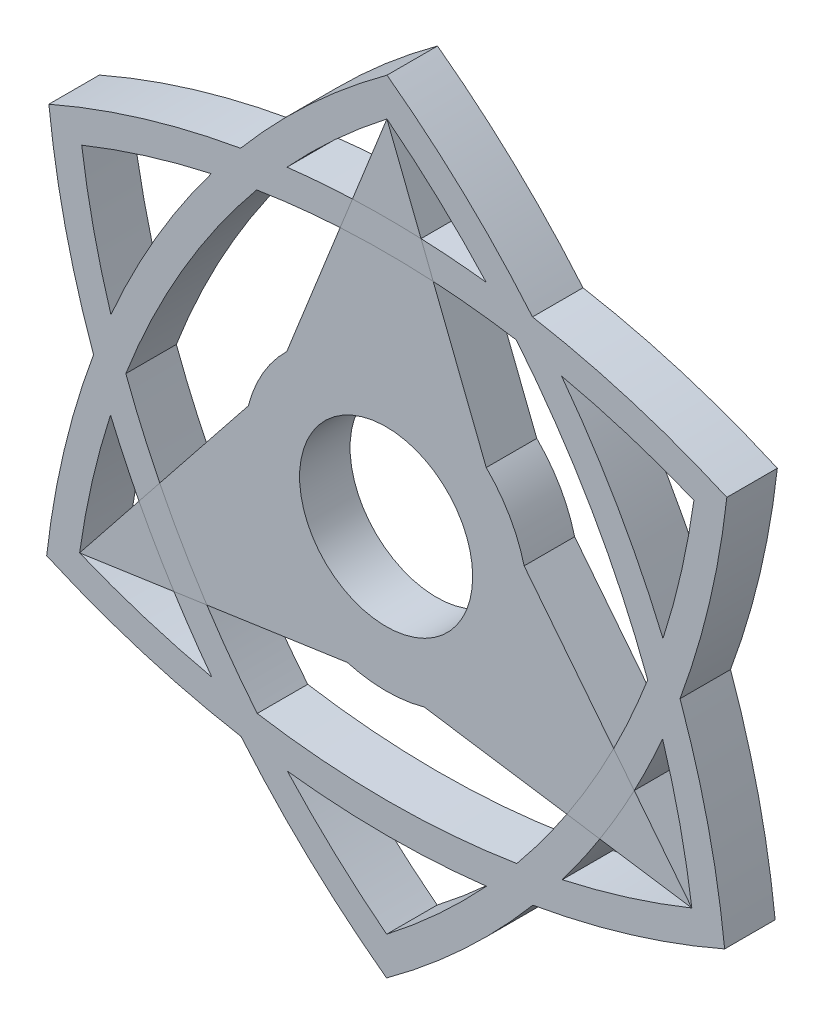
from build123d import *

# Parameters (mm, degrees)
SKETCH1_R             = 10.8839
BOSS_EXTRUDE6_DEPTH   = 6.35
BOSS_EXTRUDE7_DEPTH   = 6.35
BOSS_EXTRUDE7_2_DEPTH = 6.35
BOSS_EXTRUDE7_3_DEPTH = 6.35
BOSS_EXTRUDE9_DEPTH   = 6.35
BOSS_EXTRUDE9_2_DEPTH = 6.35
BOSS_EXTRUDE9_3_DEPTH = 6.35


with BuildPart() as part:
    # Sketch1 → Boss-Extrude6 (new body)
    # profile 1 of 24: a face of its own
    with BuildSketch(Plane.XY):
        with BuildLine():
            ThreePointArc((18.409251134, 32.040755516), (9.771738625, 41.176595763), (0.112502824, 49.224537306))
            ThreePointArc((0.112502824, 49.224537306), (-9.606010304, 41.189697913), (-18.30255483, 32.058528504))
            ThreePointArc((-18.30255483, 32.058528504), (-30.571274802, 29.148703665), (-42.408118658, 24.803856385))
            ThreePointArc((-42.408118658, 24.803856385), (-40.332235459, 12.393212957), (-36.795986587, 0.317273851))
            ThreePointArc((-36.795986587, 0.317273851), (-40.490763243, -11.918086648), (-42.687382874, -24.508967606))
            ThreePointArc((-42.687382874, -24.508967606), (-30.690753758, -28.982480099), (-18.241181413, -31.972391907))
            ThreePointArc((-18.241181413, -31.972391907), (-9.602962869, -41.094540725), (0.056729858, -49.127146472))
            ThreePointArc((0.056729858, -49.127146472), (9.767597292, -41.108146164), (18.457974155, -31.993177034))
            ThreePointArc((18.457974155, -31.993177034), (30.732404751, -29.071478393), (42.571147661, -24.707748829))
            ThreePointArc((42.571147661, -24.707748829), (40.489963723, -12.317504428), (36.956222495, -0.260881524))
            ThreePointArc((36.956222495, -0.260881524), (40.654785447, 11.998056292), (42.846932906, 24.613737558))
            ThreePointArc((42.846932906, 24.613737558), (30.852413337, 29.065348019), (18.409251134, 32.040755516))
        make_face()
        with BuildLine():
            ThreePointArc((0.065018844, -44.354977085), (-6.415368802, -38.856188804), (-12.414843436, -32.836354861))
            ThreePointArc((-12.414843436, -32.836354861), (0.09972186, -33.588017728), (12.615238804, -32.852370236))
            ThreePointArc((12.615238804, -32.852370236), (6.5802827, -38.865699826), (0.065018844, -44.354977085))
        make_face(mode=Mode.SUBTRACT)
        with BuildLine():
            ThreePointArc((-34.606466943, 5.778884121), (-36.791953917, 14.014759026), (-38.281510247, 22.404467645))
            ThreePointArc((-38.281510247, 22.404467645), (-30.237565046, 25.267072232), (-21.982893443, 27.448804603))
            ThreePointArc((-21.982893443, 27.448804603), (-28.937245051, 16.988163443), (-34.606466943, 5.778884121))
        make_face(mode=Mode.SUBTRACT)
        with BuildLine():
            ThreePointArc((-12.466293025, 32.914387652), (-6.422477615, 38.944419206), (0.103176208, 44.449401263))
            ThreePointArc((0.103176208, 44.449401263), (6.588409661, 38.935289866), (12.591776477, 32.900120912))
            ThreePointArc((12.591776477, 32.900120912), (8.497755055, 33.309033762), (4.390957045, 33.558896188))
            Line((4.390957045, 33.558896188), (5.92278391, 29.668219663))
            ThreePointArc((5.92278391, 29.668219663), (11.164564982, 29.228828773), (16.376824404, 28.520531604))
            ThreePointArc((16.376824404, 28.520531604), (25.810048875, 14.814094453), (32.891805284, -0.242494452))
            ThreePointArc((32.891805284, -0.242494452), (30.876080007, -5.106091555), (28.612333437, -9.859319578))
            Line((28.612333437, -9.859319578), (31.202189282, -13.140569782))
            ThreePointArc((31.202189282, -13.140569782), (33.056613624, -9.465908645), (34.766856331, -5.721967675))
            ThreePointArc((34.766856331, -5.721967675), (36.950597113, -13.941399376), (38.442722573, -22.314053849))
            ThreePointArc((38.442722573, -22.314053849), (30.400141756, -25.188442382), (22.14505035, -27.379031691))
            ThreePointArc((22.14505035, -27.379031691), (24.575188757, -24.02304644), (26.872201387, -20.574576828))
            Line((26.872201387, -20.574576828), (22.732716478, -19.952259237))
            ThreePointArc((22.732716478, -19.952259237), (19.694383336, -24.293248434), (16.434939913, -28.470769715))
            ThreePointArc((16.434939913, -28.470769715), (0.112106411, -29.778024387), (-16.209299898, -28.453069887))
            ThreePointArc((-16.209299898, -28.453069887), (-19.491550025, -24.212899505), (-22.546142131, -19.805896234))
            Line((-22.546142131, -19.805896234), (-26.68787682, -20.408903453))
            ThreePointArc((-26.68787682, -20.408903453), (-24.364609338, -23.931538597), (-21.902564268, -27.358616685))
            ThreePointArc((-21.902564268, -27.358616685), (-30.336237741, -25.103876714), (-38.545898781, -22.135347415))
            ThreePointArc((-38.545898781, -22.135347415), (-36.962894769, -13.566034677), (-34.656199101, -5.162572439))
            ThreePointArc((-34.656199101, -5.162572439), (-32.94297759, -8.999031831), (-31.078611103, -12.764358672))
            Line((-31.078611103, -12.764358672), (-28.470486825, -9.491322424))
            ThreePointArc((-28.470486825, -9.491322424), (-30.729374769, -4.652110953), (-32.731554183, 0.298830371))
            ThreePointArc((-32.731554183, 0.298830371), (-25.640389338, 15.078468804), (-16.279166072, 28.535430944))
            ThreePointArc((-16.279166072, 28.535430944), (-11.044682926, 29.24131847), (-5.780739025, 29.676043211))
            Line((-5.780739025, 29.676043211), (-4.231792218, 33.565145089))
            ThreePointArc((-4.231792218, 33.565145089), (-8.355378448, 33.319938131), (-12.466293025, 32.914387652))
        make_face(mode=Mode.SUBTRACT)
        with BuildLine():
            ThreePointArc((22.061661473, 27.432655446), (30.49539453, 25.18862754), (38.707129377, 22.233813619))
            ThreePointArc((38.707129377, 22.233813619), (37.125952887, 13.643513921), (34.816355895, 5.219789701))
            ThreePointArc((34.816355895, 5.219789701), (29.112988802, 16.713223988), (22.061661473, 27.432655446))
        make_face(mode=Mode.SUBTRACT)
    # profile 2 of 24: a face of its own
    with BuildSketch(Plane.XY):
        with BuildLine():
            Line((28.612333437, -9.859319578), (17.355543552, 4.402610931))
            ThreePointArc((17.355543552, 4.402610931), (17.767289769, 2.218397904), (17.905247136, 0))
            ThreePointArc((17.905247136, 0), (14.252606705, -10.837946166), (4.784950475, -17.254046596))
            Line((4.784950475, -17.254046596), (22.732716478, -19.952259237))
            ThreePointArc((22.732716478, -19.952259237), (25.816973791, -14.989937717), (28.612333437, -9.859319578))
        make_face()
    # profile 3 of 24: a face of its own
    with BuildSketch(Plane.XY):
        with BuildLine():
            ThreePointArc((0.855698515, 17.88478837), (0.613501389, 17.894733612), (0.371191823, 17.901399153))
            add(Edge.make_bspline(
                [(-0.457896071, 16.620461479), (-0.456345669, 16.654814091), (-0.45331947, 16.721866244), (-0.446453992, 16.819875103), (-0.436982287, 16.912792733), (-0.424936518, 17.000622781), (-0.410565326, 17.083218743), (-0.393050996, 17.160542787), (-0.374448988, 17.232885934), (-0.352587387, 17.300724297), (-0.32714287, 17.364906318), (-0.296632223, 17.426403351), (-0.259824473, 17.48477755), (-0.219348783, 17.541715904), (-0.173074336, 17.595859989), (-0.12225701, 17.648106237), (-0.066069886, 17.697775095), (-0.005261137, 17.744433175), (0.059072625, 17.788169664), (0.128082627, 17.824525995), (0.199365721, 17.856413546), (0.274214301, 17.880115675), (0.331872819, 17.893994249), (0.364487692, 17.900195643), (0.371191823, 17.901399153)],
                knots=[0, 0, 0, 0, 1.299619728, 2.536700842, 3.712695391, 4.828862452, 5.886674754, 6.880040802, 7.824574118, 8.708903084, 9.57188436, 10.43188469, 11.299059094, 12.177414763, 13.06998165, 13.987903038, 14.930122486, 15.901331799, 16.883583912, 17.865836025, 18.845371881, 19.831049498, 20.828028267, 21.085378132, 21.085378132, 21.085378132, 21.085378132], degree=3))
            Line((-0.457896071, 16.620461479), (-0.524677922, 14.714316647))
            Line((-0.524677922, 14.714316647), (-0.209213179, 14.703504347))
            Line((-0.209213179, 14.703504347), (-0.142431328, 16.609649179))
            add(Edge.make_bspline(
                [(-0.09345797, 17.102562841), (-0.096306428, 17.091348489), (-0.102666094, 17.066310537), (-0.110862748, 17.024544277), (-0.117488281, 16.974808947), (-0.123877271, 16.917343388), (-0.129488814, 16.851807376), (-0.134488672, 16.778227129), (-0.138955045, 16.696597684), (-0.141236045, 16.639545487), (-0.142431328, 16.609649179)],
                knots=[0, 0, 0, 0, 0.559594287, 1.249389564, 2.057148588, 2.985725436, 4.045954676, 5.238292363, 6.552818884, 8, 8, 8, 8], degree=3))
            add(Edge.make_bspline(
                [(0.608705491, 17.614557032), (0.582816829, 17.614698761), (0.531058639, 17.614982116), (0.453949109, 17.605243583), (0.378305875, 17.586532359), (0.304966875, 17.559670022), (0.234568169, 17.526694783), (0.16967617, 17.48532422), (0.110389919, 17.437520718), (0.056648904, 17.383270756), (0.00926374, 17.322405525), (-0.031365747, 17.254950442), (-0.066909484, 17.181657766), (-0.084487435, 17.129288427), (-0.09345797, 17.102562841)],
                knots=[0, 0, 0, 0, 0.993288033, 1.985841904, 2.97501831, 3.97932036, 4.980648652, 5.95402207, 6.926612226, 7.899440832, 8.879734054, 9.880764484, 10.918492892, 12, 12, 12, 12], degree=3))
            add(Edge.make_bspline(
                [(1.319137182, 16.981719492), (1.315503175, 17.011918797), (1.308476436, 17.070312356), (1.288336589, 17.15383367), (1.258656697, 17.229465781), (1.221474535, 17.298902686), (1.174236323, 17.362648618), (1.114787954, 17.420003573), (1.04392303, 17.472206508), (0.963701476, 17.518976957), (0.87739428, 17.558405401), (0.788642633, 17.588623725), (0.699003509, 17.608513848), (0.638693279, 17.612550103), (0.608705491, 17.614557032)],
                knots=[0, 0, 0, 0, 1.04589677, 2.022352351, 2.946065672, 3.833745878, 4.725014376, 5.663694529, 6.664364763, 7.746384492, 8.852808633, 9.922989148, 10.967257112, 12, 12, 12, 12], degree=3))
            add(Edge.make_bspline(
                [(1.317229129, 16.558131751), (1.318107631, 16.585055556), (1.319781502, 16.63635539), (1.3216889, 16.709287081), (1.322988933, 16.774373215), (1.323695892, 16.83119476), (1.323625774, 16.88016716), (1.323410983, 16.921116791), (1.32131841, 16.954178803), (1.319791888, 16.973453027), (1.319137182, 16.981719492)],
                knots=[0, 0, 0, 0, 1.52551092, 2.906664143, 4.13150577, 5.212107384, 6.124559092, 6.905037769, 7.530384945, 8, 8, 8, 8], degree=3))
            Line((1.317229129, 16.558131751), (1.250447278, 14.651986919))
            Line((1.250447278, 14.651986919), (1.565912022, 14.64117462))
            Line((1.565912022, 14.64117462), (1.632693873, 16.547319452))
            add(Edge.make_bspline(
                [(1.598348921, 17.215137961), (1.602654197, 17.198021853), (1.611936341, 17.16111965), (1.620665117, 17.100391245), (1.62854445, 17.030852405), (1.633165433, 16.95187423), (1.6362796, 16.863660024), (1.637623505, 16.766320812), (1.636097314, 16.659875055), (1.633860513, 16.585901538), (1.632693873, 16.547319452)],
                knots=[0, 0, 0, 0, 0.631203374, 1.360869828, 2.192817587, 3.135525521, 4.190760322, 5.351626202, 6.618697716, 8, 8, 8, 8], degree=3))
            add(Edge.make_bspline(
                [(0.855698515, 17.88478837), (0.861146601, 17.883580192), (0.894467689, 17.87594505), (0.95443514, 17.859407171), (1.033738504, 17.830644331), (1.109366822, 17.796265902), (1.181757029, 17.756667206), (1.250023788, 17.711775307), (1.313653036, 17.662249422), (1.371622238, 17.608730284), (1.424088486, 17.551686285), (1.471414408, 17.491743125), (1.511370599, 17.427289865), (1.546738044, 17.360345859), (1.576303994, 17.289483978), (1.590949215, 17.240093301), (1.598348921, 17.215137961)],
                knots=[3.134053917, 3.134053917, 3.134053917, 3.134053917, 3.338813893, 4.38833459, 5.414671971, 6.43140945, 7.434238892, 8.439841251, 9.426575211, 10.390122985, 11.331682402, 12.268601345, 13.188173267, 14.110407429, 15.045256545, 16, 16, 16, 16], degree=3))
        make_face()
    # profile 4 of 24: a face of its own
    with BuildSketch(Plane.XY):
        with BuildLine():
            add(Edge.make_bspline(
                [(0.371191823, 17.901399153), (0.391323472, 17.905013138), (0.439130981, 17.912081833), (0.516192621, 17.91718489), (0.572872168, 17.916419035), (0.601709297, 17.916029387)],
                knots=[21.085378132, 21.085378132, 21.085378132, 21.085378132, 21.858166885, 22.91028912, 24, 24, 24, 24], degree=3))
            ThreePointArc((0.371191823, 17.901399153), (0.613501389, 17.894733612), (0.855698515, 17.88478837))
            add(Edge.make_bspline(
                [(0.601709297, 17.916029387), (0.632903846, 17.914276755), (0.694402997, 17.910821492), (0.779205954, 17.900088876), (0.832443083, 17.889945542), (0.855698515, 17.88478837)],
                knots=[0, 0, 0, 0, 1.146365092, 2.260025618, 3.134053917, 3.134053917, 3.134053917, 3.134053917], degree=3))
        make_face()
    # profile 5 of 24: a face of its own
    with BuildSketch(Plane.XY):
        with BuildLine():
            ThreePointArc((-4.864998867, -17.231647078), (-15.527137932, -8.916606004), (-17.334917908, 4.483134631))
            Line((-17.334917908, 4.483134631), (-28.470486825, -9.491322424))
            ThreePointArc((-28.470486825, -9.491322424), (-25.658990725, -14.735152703), (-22.546142131, -19.805896234))
            Line((-22.546142131, -19.805896234), (-4.864998867, -17.231647078))
        make_face()
    # profile 6 of 24: a face of its own
    with BuildSketch(Plane.XY):
        with BuildLine():
            ThreePointArc((0.371191823, 17.901399153), (-6.569010204, 16.656709757), (-12.490544685, 12.829036147))
            ThreePointArc((-12.490544685, 12.829036147), (-15.485576281, 8.988592896), (-17.334917908, 4.483134631))
            ThreePointArc((-17.334917908, 4.483134631), (-15.527137932, -8.916606004), (-4.864998867, -17.231647078))
            ThreePointArc((-4.864998867, -17.231647078), (-0.041561651, -17.905198899), (4.784950475, -17.254046596))
            ThreePointArc((4.784950475, -17.254046596), (14.252606705, -10.837946166), (17.905247136, 0))
            ThreePointArc((17.905247136, 0), (17.767289769, 2.218397904), (17.355543552, 4.402610931))
            ThreePointArc((17.355543552, 4.402610931), (15.541736101, 8.891136821), (12.591776477, 12.729691283))
            ThreePointArc((12.591776477, 12.729691283), (7.200861227, 16.393458226), (0.855698515, 17.88478837))
            add(Edge.make_bspline(
                [(0.855698515, 17.88478837), (0.861146601, 17.883580192), (0.894467689, 17.87594505), (0.95443514, 17.859407171), (1.033738504, 17.830644331), (1.109366822, 17.796265902), (1.181757029, 17.756667206), (1.250023788, 17.711775307), (1.313653036, 17.662249422), (1.371622238, 17.608730284), (1.424088486, 17.551686285), (1.471414408, 17.491743125), (1.511370599, 17.427289865), (1.546738044, 17.360345859), (1.576303994, 17.289483978), (1.590949215, 17.240093301), (1.598348921, 17.215137961)],
                knots=[3.134053917, 3.134053917, 3.134053917, 3.134053917, 3.338813893, 4.38833459, 5.414671971, 6.43140945, 7.434238892, 8.439841251, 9.426575211, 10.390122985, 11.331682402, 12.268601345, 13.188173267, 14.110407429, 15.045256545, 16, 16, 16, 16], degree=3))
            add(Edge.make_bspline(
                [(1.598348921, 17.215137961), (1.602654197, 17.198021853), (1.611936341, 17.16111965), (1.620665117, 17.100391245), (1.62854445, 17.030852405), (1.633165433, 16.95187423), (1.6362796, 16.863660024), (1.637623505, 16.766320812), (1.636097314, 16.659875055), (1.633860513, 16.585901538), (1.632693873, 16.547319452)],
                knots=[0, 0, 0, 0, 0.631203374, 1.360869828, 2.192817587, 3.135525521, 4.190760322, 5.351626202, 6.618697716, 8, 8, 8, 8], degree=3))
            Line((1.632693873, 16.547319452), (1.565912022, 14.64117462))
            Line((1.565912022, 14.64117462), (1.250447278, 14.651986919))
            Line((1.250447278, 14.651986919), (1.317229129, 16.558131751))
            add(Edge.make_bspline(
                [(1.317229129, 16.558131751), (1.318107631, 16.585055556), (1.319781502, 16.63635539), (1.3216889, 16.709287081), (1.322988933, 16.774373215), (1.323695892, 16.83119476), (1.323625774, 16.88016716), (1.323410983, 16.921116791), (1.32131841, 16.954178803), (1.319791888, 16.973453027), (1.319137182, 16.981719492)],
                knots=[0, 0, 0, 0, 1.52551092, 2.906664143, 4.13150577, 5.212107384, 6.124559092, 6.905037769, 7.530384945, 8, 8, 8, 8], degree=3))
            add(Edge.make_bspline(
                [(1.319137182, 16.981719492), (1.315503175, 17.011918797), (1.308476436, 17.070312356), (1.288336589, 17.15383367), (1.258656697, 17.229465781), (1.221474535, 17.298902686), (1.174236323, 17.362648618), (1.114787954, 17.420003573), (1.04392303, 17.472206508), (0.963701476, 17.518976957), (0.87739428, 17.558405401), (0.788642633, 17.588623725), (0.699003509, 17.608513848), (0.638693279, 17.612550103), (0.608705491, 17.614557032)],
                knots=[0, 0, 0, 0, 1.04589677, 2.022352351, 2.946065672, 3.833745878, 4.725014376, 5.663694529, 6.664364763, 7.746384492, 8.852808633, 9.922989148, 10.967257112, 12, 12, 12, 12], degree=3))
            add(Edge.make_bspline(
                [(0.608705491, 17.614557032), (0.582816829, 17.614698761), (0.531058639, 17.614982116), (0.453949109, 17.605243583), (0.378305875, 17.586532359), (0.304966875, 17.559670022), (0.234568169, 17.526694783), (0.16967617, 17.48532422), (0.110389919, 17.437520718), (0.056648904, 17.383270756), (0.00926374, 17.322405525), (-0.031365747, 17.254950442), (-0.066909484, 17.181657766), (-0.084487435, 17.129288427), (-0.09345797, 17.102562841)],
                knots=[0, 0, 0, 0, 0.993288033, 1.985841904, 2.97501831, 3.97932036, 4.980648652, 5.95402207, 6.926612226, 7.899440832, 8.879734054, 9.880764484, 10.918492892, 12, 12, 12, 12], degree=3))
            add(Edge.make_bspline(
                [(-0.09345797, 17.102562841), (-0.096306428, 17.091348489), (-0.102666094, 17.066310537), (-0.110862748, 17.024544277), (-0.117488281, 16.974808947), (-0.123877271, 16.917343388), (-0.129488814, 16.851807376), (-0.134488672, 16.778227129), (-0.138955045, 16.696597684), (-0.141236045, 16.639545487), (-0.142431328, 16.609649179)],
                knots=[0, 0, 0, 0, 0.559594287, 1.249389564, 2.057148588, 2.985725436, 4.045954676, 5.238292363, 6.552818884, 8, 8, 8, 8], degree=3))
            Line((-0.142431328, 16.609649179), (-0.209213179, 14.703504347))
            Line((-0.209213179, 14.703504347), (-0.524677922, 14.714316647))
            Line((-0.524677922, 14.714316647), (-0.457896071, 16.620461479))
            add(Edge.make_bspline(
                [(-0.457896071, 16.620461479), (-0.456345669, 16.654814091), (-0.45331947, 16.721866244), (-0.446453992, 16.819875103), (-0.436982287, 16.912792733), (-0.424936518, 17.000622781), (-0.410565326, 17.083218743), (-0.393050996, 17.160542787), (-0.374448988, 17.232885934), (-0.352587387, 17.300724297), (-0.32714287, 17.364906318), (-0.296632223, 17.426403351), (-0.259824473, 17.48477755), (-0.219348783, 17.541715904), (-0.173074336, 17.595859989), (-0.12225701, 17.648106237), (-0.066069886, 17.697775095), (-0.005261137, 17.744433175), (0.059072625, 17.788169664), (0.128082627, 17.824525995), (0.199365721, 17.856413546), (0.274214301, 17.880115675), (0.331872819, 17.893994249), (0.364487692, 17.900195643), (0.371191823, 17.901399153)],
                knots=[0, 0, 0, 0, 1.299619728, 2.536700842, 3.712695391, 4.828862452, 5.886674754, 6.880040802, 7.824574118, 8.708903084, 9.57188436, 10.43188469, 11.299059094, 12.177414763, 13.06998165, 13.987903038, 14.930122486, 15.901331799, 16.883583912, 17.865836025, 18.845371881, 19.831049498, 20.828028267, 21.085378132, 21.085378132, 21.085378132, 21.085378132], degree=3))
        make_face()
        Circle(SKETCH1_R, mode=Mode.SUBTRACT)
        Polygon((-8.371094322, 15.75088473), (-5.690916037, 13.611957446), (-5.99302441, 13.450408968), (-8.06326179, 15.103418784), (-7.848923849, 12.45504138), (-8.151032223, 12.293492903), (-8.431515997, 15.718447831), align=None, mode=Mode.SUBTRACT)
        with BuildLine():
            add(Edge.make_bspline(
                [(-3.178846948, 16.014342466), (-3.168338806, 15.978224946), (-3.147488214, 15.906559414), (-3.126016875, 15.797517449), (-3.109424871, 15.688943189), (-3.101193225, 15.580085763), (-3.10098465, 15.471117147), (-3.106219918, 15.362081166), (-3.119995603, 15.253151239), (-3.140003977, 15.144730896), (-3.167683027, 15.038289551), (-3.200188172, 14.934261083), (-3.24076321, 14.834501974), (-3.286418069, 14.737719695), (-3.339435774, 14.645140549), (-3.398149521, 14.555626638), (-3.463014111, 14.46965435), (-3.534274961, 14.387906833), (-3.610128842, 14.310614861), (-3.690401031, 14.238857486), (-3.775505363, 14.174433489), (-3.863157083, 14.113891475), (-3.955479012, 14.060797468), (-4.051496247, 14.013434378), (-4.151330154, 13.971879463), (-4.22027289, 13.949176773), (-4.254988775, 13.93774491)],
                knots=[0, 0, 0, 0, 1.04023538, 2.064068123, 3.071965347, 4.077897774, 5.08095297, 6.085379304, 7.095952736, 8.116402512, 9.133610292, 10.137197026, 11.129492329, 12.110752003, 13.095861141, 14.078504858, 15.070990848, 16.073067965, 17.076843242, 18.065699879, 19.048851173, 20.028268269, 21.011209563, 21.992311438, 22.989035108, 24, 24, 24, 24], degree=3))
            add(Edge.make_bspline(
                [(-4.254988775, 13.93774491), (-4.311338534, 13.921822176), (-4.42192418, 13.890574024), (-4.589884034, 13.862847899), (-4.754943061, 13.850962452), (-4.917722005, 13.856289097), (-5.077848334, 13.876994696), (-5.235491414, 13.915082573), (-5.390458799, 13.969254368), (-5.541006151, 14.039879923), (-5.684242887, 14.123537045), (-5.816707847, 14.219220403), (-5.936361166, 14.32612357), (-6.043958162, 14.443812775), (-6.139099732, 14.572764549), (-6.221095694, 14.713077098), (-6.292232757, 14.863711885), (-6.327594359, 14.970425934), (-6.345578719, 15.024699036)],
                knots=[0, 0, 0, 0, 1.067981116, 2.095898626, 3.100429973, 4.083685638, 5.06320398, 6.042011382, 7.038079475, 8.05416861, 9.072119813, 10.061212317, 11.031270349, 11.995306436, 12.966498098, 13.949921228, 14.957361882, 16, 16, 16, 16], degree=3))
            add(Edge.make_bspline(
                [(-6.345578719, 15.024699036), (-6.360818496, 15.079365823), (-6.390780232, 15.186841923), (-6.417390326, 15.350291196), (-6.427904678, 15.511784312), (-6.421365166, 15.671402132), (-6.399129307, 15.829169876), (-6.359836398, 15.984809901), (-6.304950431, 16.138927886), (-6.233780059, 16.28892086), (-6.150361016, 16.432554142), (-6.053886491, 16.564627034), (-5.946837094, 16.684433237), (-5.829822102, 16.792585016), (-5.700797184, 16.887056011), (-5.561684722, 16.969194229), (-5.411839192, 17.039538939), (-5.306089477, 17.074986216), (-5.252264416, 17.093028363)],
                knots=[0, 0, 0, 0, 1.044744885, 2.053991299, 3.043984018, 4.02106804, 4.99142511, 5.973623099, 6.972907553, 8.000119669, 9.02755446, 10.028158173, 11.007253604, 11.982908415, 12.957687483, 13.94690966, 14.955006987, 16, 16, 16, 16], degree=3))
            add(Edge.make_bspline(
                [(-5.252264416, 17.093028363), (-5.197189364, 17.108561319), (-5.088737493, 17.139148274), (-4.923645561, 17.165214668), (-4.760777914, 17.17663151), (-4.599813881, 17.170914912), (-4.441299744, 17.148404081), (-4.284884481, 17.109915774), (-4.130586325, 17.055020253), (-3.980368407, 16.983837123), (-3.837155741, 16.900239734), (-3.704742757, 16.805210371), (-3.584923673, 16.699601121), (-3.477432549, 16.583448369), (-3.383219657, 16.456298252), (-3.301231743, 16.319216838), (-3.231856252, 16.171530815), (-3.196708475, 16.067307203), (-3.178846948, 16.014342466)],
                knots=[0, 0, 0, 0, 1.05472773, 2.076933069, 3.07633902, 4.062428051, 5.041857081, 6.024458353, 7.028794547, 8.057412686, 9.086253806, 10.083637906, 11.05888134, 12.02746914, 12.99729554, 13.972429203, 14.969621627, 16, 16, 16, 16], degree=3))
        make_face(mode=Mode.SUBTRACT)
        Polygon((-1.194685827, 17.841590607), (-0.821979497, 14.713019894), (-1.140624329, 14.674858837), (-1.280548207, 15.848947378), (-2.389126933, 14.526030712), (-2.812078656, 14.475785319), (-1.475805619, 16.058197178), (-3.30181223, 17.590363644), (-2.887128736, 17.639337002), (-1.339697847, 16.344405111), (-1.513330659, 17.80342955), align=None, mode=Mode.SUBTRACT)
        Polygon((17.658485202, 2.926546227), (14.559171299, 2.385931243), (14.505109801, 2.695671828), (17.604423703, 3.236286812), align=None, mode=Mode.SUBTRACT)
        with BuildLine():
            Line((17.43911139, 3.943072906), (14.398311109, 3.082541055))
            Line((14.398311109, 3.082541055), (14.22658635, 3.688029837))
            add(Edge.make_bspline(
                [(14.22658635, 3.688029837), (14.215197403, 3.728481862), (14.193356346, 3.806058399), (14.164453944, 3.91794275), (14.138527285, 4.019759906), (14.117750578, 4.112095019), (14.100184792, 4.194474248), (14.087694373, 4.267078886), (14.077966598, 4.329557781), (14.075204308, 4.368120491), (14.073942119, 4.385741175)],
                knots=[0, 0, 0, 0, 1.4100874, 2.70418349, 3.877430536, 4.93531605, 5.879852791, 6.703218142, 7.407453871, 8, 8, 8, 8], degree=3))
            add(Edge.make_bspline(
                [(14.073942119, 4.385741175), (14.073089543, 4.409490131), (14.071405651, 4.456395829), (14.076349121, 4.525923909), (14.085521223, 4.593647265), (14.101089749, 4.659294724), (14.12125156, 4.722983813), (14.147149079, 4.784514824), (14.17753088, 4.84452168), (14.213755683, 4.902176921), (14.254724494, 4.956531514), (14.300457871, 5.006826577), (14.35074027, 5.052560633), (14.405392376, 5.093963297), (14.464754746, 5.130464588), (14.528022164, 5.162838619), (14.596228558, 5.1904194), (14.643695476, 5.205068617), (14.667982584, 5.212564092)],
                knots=[0, 0, 0, 0, 1.030839657, 2.035973936, 3.021152875, 3.994397149, 4.960611458, 5.917667131, 6.888951631, 7.877091714, 8.869123558, 9.839753921, 10.823384377, 11.815416221, 12.811367135, 13.844381518, 14.897047834, 16, 16, 16, 16], degree=3))
            add(Edge.make_bspline(
                [(14.667982584, 5.212564092), (14.708482896, 5.222601884), (14.787658426, 5.242225128), (14.907856913, 5.25199563), (15.024679475, 5.246257955), (15.137273634, 5.222089974), (15.24481618, 5.18322891), (15.344279215, 5.125975185), (15.436284728, 5.054137775), (15.5047784, 4.981161622), (15.556118053, 4.914826052), (15.593471675, 4.858246891), (15.628962108, 4.795583704), (15.66338592, 4.727258257), (15.696535315, 4.652852135), (15.72724952, 4.571953918), (15.757456477, 4.485566759), (15.775128898, 4.425470359), (15.784193521, 4.394645422)],
                knots=[0, 0, 0, 0, 1.271559767, 2.48581831, 3.665083899, 4.828645136, 5.987213336, 7.14036768, 8.315526516, 9.537413767, 10.18315562, 10.873993568, 11.604241575, 12.379664224, 13.20801615, 14.088706782, 15.019650197, 16, 16, 16, 16], degree=3))
            Line((15.784193521, 4.394645422), (16.888320124, 5.888014813))
            Line((16.888320124, 5.888014813), (16.994535068, 5.512128395))
            Line((16.994535068, 5.512128395), (15.889772447, 4.020667057))
            Line((15.889772447, 4.020667057), (15.939381822, 3.847034244))
            Line((15.939381822, 3.847034244), (17.35324901, 4.247089332))
            Line((17.35324901, 4.247089332), (17.43911139, 3.943072906))
        make_face(mode=Mode.SUBTRACT)
        Polygon((16.695693478, 6.452075259), (13.771920441, 5.294523175), (13.656801251, 5.586455267), (16.580574287, 6.74400735), align=None, mode=Mode.SUBTRACT)
        Polygon((17.87726236, 0.384154647), (14.719434836, 0.152008213), (14.695266166, 0.473833133), (15.880167008, 0.560967548), (14.60304361, 1.734420072), (14.571878747, 2.161187901), (16.100229107, 0.747956731), (17.720802024, 2.511633614), (17.75133087, 2.093134014), (16.380712881, 0.597856571), (17.85309369, 0.705979567), align=None, mode=Mode.SUBTRACT)
        Polygon((16.289796364, 7.39072034), (13.45379376, 5.983213329), (13.311961829, 6.268149226), (15.874476853, 7.540184483), (15.333861869, 8.62968268), (15.607349449, 8.765154435), align=None, mode=Mode.SUBTRACT)
        Polygon((15.346887814, 9.189648467), (12.686426075, 7.468584765), (12.512793262, 7.736348187), (14.916303879, 9.291411288), (14.255481564, 10.313491616), (14.512432685, 10.479492217), align=None, mode=Mode.SUBTRACT)
        Polygon((13.188064858, 12.036120952), (13.42084731, 11.805882571), (11.192241541, 9.554380167), (11.143268184, 9.602717507), (11.352517983, 12.807610335), (9.646718705, 11.084002563), (9.424748552, 11.303428644), (11.653354322, 13.554931048), (11.703599714, 13.505321673), (11.503254161, 10.334137779), align=None, mode=Mode.SUBTRACT)
        Polygon((3.210977562, 16.032100398), (3.902964742, 14.223266263), (3.544886817, 14.291320149), (2.996639622, 15.719179725), (1.973287258, 14.590884452), (1.615209333, 14.659574356), (2.905689101, 16.089978002), (3.188080928, 17.571263058), (3.493369389, 17.513385454), align=None, mode=Mode.SUBTRACT)
        with BuildLine():
            Line((6.782721822, 16.543493273), (5.738380876, 13.561206614))
            Line((5.738380876, 13.561206614), (5.144340412, 13.769184379))
            add(Edge.make_bspline(
                [(5.144340412, 13.769184379), (5.104668288, 13.783314252), (5.028600273, 13.810407115), (4.920022818, 13.850408677), (4.821876245, 13.887674796), (4.73438533, 13.923515072), (4.6571294, 13.956885031), (4.590317471, 13.988034361), (4.533734242, 14.016271679), (4.500589928, 14.036130476), (4.485426149, 14.045216029)],
                knots=[0, 0, 0, 0, 1.412712571, 2.708759457, 3.88162108, 4.934207843, 5.880198864, 6.704260312, 7.4071891, 8, 8, 8, 8], degree=3))
            add(Edge.make_bspline(
                [(4.485426149, 14.045216029), (4.465667828, 14.058224336), (4.426509619, 14.084004967), (4.372856939, 14.128332957), (4.322558643, 14.174735375), (4.277696366, 14.224972761), (4.237032504, 14.278200094), (4.201726441, 14.334848356), (4.170128734, 14.394429287), (4.143645165, 14.456946264), (4.122434641, 14.521785722), (4.108125695, 14.588105502), (4.098605205, 14.655489848), (4.097214738, 14.723905231), (4.101124293, 14.79341807), (4.110344996, 14.86397396), (4.127290601, 14.935521924), (4.142500934, 14.98280288), (4.150244859, 15.006874683)],
                knots=[0, 0, 0, 0, 1.026415021, 2.03420995, 3.017620675, 3.99537125, 4.954572974, 5.922524674, 6.890169928, 7.880107598, 8.866958938, 9.847435649, 10.822539369, 11.817088574, 12.812787326, 13.843856194, 14.902258456, 16, 16, 16, 16], degree=3))
            add(Edge.make_bspline(
                [(4.150244859, 15.006874683), (4.16526575, 15.045963464), (4.194589323, 15.122272033), (4.256095708, 15.226073348), (4.328562362, 15.317772339), (4.412813274, 15.396330122), (4.50726057, 15.460662753), (4.610375807, 15.510726519), (4.722381026, 15.543410442), (4.821392408, 15.558400204), (4.905190198, 15.561611484), (4.972947725, 15.559492851), (5.044770064, 15.553233951), (5.120494375, 15.541438317), (5.20024121, 15.525358411), (5.284150406, 15.505140547), (5.372063422, 15.47940086), (5.431667072, 15.459689674), (5.462349226, 15.449542952)],
                knots=[0, 0, 0, 0, 1.275705158, 2.490413695, 3.664205729, 4.831206169, 5.990148558, 7.138647525, 8.313276843, 9.536291763, 10.183617193, 10.869508408, 11.603258065, 12.381715302, 13.206237198, 14.08475417, 15.014089474, 16, 16, 16, 16], degree=3))
            Line((5.462349226, 15.449542952), (4.874668937, 17.211311783))
            Line((4.874668937, 17.211311783), (5.244195179, 17.082200204))
            Line((5.244195179, 17.082200204), (5.829331397, 15.320431374))
            Line((5.829331397, 15.320431374), (5.999148104, 15.261281735))
            Line((5.999148104, 15.261281735), (6.484429554, 16.647800164))
            Line((6.484429554, 16.647800164), (6.782721822, 16.543493273))
        make_face(mode=Mode.SUBTRACT)
        Polygon((9.127104502, 15.376789313), (7.647091482, 12.57004352), (7.360883549, 12.720779698), (7.916126938, 13.77402489), (6.240856506, 13.311640074), (5.861153982, 13.511985627), (7.874149775, 14.059596805), (7.236224094, 16.374064954), (7.608294406, 16.177535507), (8.150817443, 14.218601212), (8.84089657, 15.527525491), align=None, mode=Mode.SUBTRACT)
        Polygon((11.069242834, 14.046725807), (9.220975607, 11.474034501), (7.746686745, 12.533003852), (7.928587786, 12.786138868), (9.145925527, 11.91161463), (9.724065551, 12.716176929), (8.516904092, 13.583704974), (8.697533099, 13.835567955), (9.904694557, 12.96803991), (10.629754653, 13.977399886), (9.422593195, 14.844927931), (9.605130254, 15.098698964), align=None, mode=Mode.SUBTRACT)
    # profile 7 of 24: a face of its own
    with BuildSketch(Plane.XY):
        with BuildLine():
            ThreePointArc((5.92278391, 29.668219663), (0.071134435, 29.839665431), (-5.780739025, 29.676043211))
            Line((-5.780739025, 29.676043211), (-12.490544685, 12.829036147))
            ThreePointArc((-12.490544685, 12.829036147), (-6.569010204, 16.656709757), (0.371191823, 17.901399153))
            add(Edge.make_bspline(
                [(0.371191823, 17.901399153), (0.391323472, 17.905013138), (0.439130981, 17.912081833), (0.516192621, 17.91718489), (0.572872168, 17.916419035), (0.601709297, 17.916029387)],
                knots=[21.085378132, 21.085378132, 21.085378132, 21.085378132, 21.858166885, 22.91028912, 24, 24, 24, 24], degree=3))
            add(Edge.make_bspline(
                [(0.601709297, 17.916029387), (0.632903846, 17.914276755), (0.694402997, 17.910821492), (0.779205954, 17.900088876), (0.832443083, 17.889945542), (0.855698515, 17.88478837)],
                knots=[0, 0, 0, 0, 1.146365092, 2.260025618, 3.134053917, 3.134053917, 3.134053917, 3.134053917], degree=3))
            ThreePointArc((0.855698515, 17.88478837), (7.200861227, 16.393458226), (12.591776477, 12.729691283))
            Line((12.591776477, 12.729691283), (5.92278391, 29.668219663))
        make_face()
    # profile 8 of 24: a face of its own
    with BuildSketch(Plane.XY):
        Polygon((14.695266166, 0.473833133), (14.719434836, 0.152008213), (17.87726236, 0.384154647), (17.85309369, 0.705979567), (16.380712881, 0.597856571), (17.75133087, 2.093134014), (17.720802024, 2.511633614), (16.100229107, 0.747956731), (14.571878747, 2.161187901), (14.60304361, 1.734420072), (15.880167008, 0.560967548), align=None)
    # profile 9 of 24: a face of its own
    with BuildSketch(Plane.XY):
        Polygon((14.505109801, 2.695671828), (14.559171299, 2.385931243), (17.658485202, 2.926546227), (17.604423703, 3.236286812), align=None)
    # profile 10 of 24: a face of its own
    with BuildSketch(Plane.XY):
        with BuildLine():
            Line((14.22658635, 3.688029837), (14.398311109, 3.082541055))
            Line((14.398311109, 3.082541055), (17.43911139, 3.943072906))
            Line((17.43911139, 3.943072906), (17.35324901, 4.247089332))
            Line((17.35324901, 4.247089332), (15.939381822, 3.847034244))
            Line((15.939381822, 3.847034244), (15.889772447, 4.020667057))
            Line((15.889772447, 4.020667057), (16.994535068, 5.512128395))
            Line((16.994535068, 5.512128395), (16.888320124, 5.888014813))
            Line((16.888320124, 5.888014813), (15.784193521, 4.394645422))
            add(Edge.make_bspline(
                [(14.667982584, 5.212564092), (14.708482896, 5.222601884), (14.787658426, 5.242225128), (14.907856913, 5.25199563), (15.024679475, 5.246257955), (15.137273634, 5.222089974), (15.24481618, 5.18322891), (15.344279215, 5.125975185), (15.436284728, 5.054137775), (15.5047784, 4.981161622), (15.556118053, 4.914826052), (15.593471675, 4.858246891), (15.628962108, 4.795583704), (15.66338592, 4.727258257), (15.696535315, 4.652852135), (15.72724952, 4.571953918), (15.757456477, 4.485566759), (15.775128898, 4.425470359), (15.784193521, 4.394645422)],
                knots=[0, 0, 0, 0, 1.271559767, 2.48581831, 3.665083899, 4.828645136, 5.987213336, 7.14036768, 8.315526516, 9.537413767, 10.18315562, 10.873993568, 11.604241575, 12.379664224, 13.20801615, 14.088706782, 15.019650197, 16, 16, 16, 16], degree=3))
            add(Edge.make_bspline(
                [(14.073942119, 4.385741175), (14.073089543, 4.409490131), (14.071405651, 4.456395829), (14.076349121, 4.525923909), (14.085521223, 4.593647265), (14.101089749, 4.659294724), (14.12125156, 4.722983813), (14.147149079, 4.784514824), (14.17753088, 4.84452168), (14.213755683, 4.902176921), (14.254724494, 4.956531514), (14.300457871, 5.006826577), (14.35074027, 5.052560633), (14.405392376, 5.093963297), (14.464754746, 5.130464588), (14.528022164, 5.162838619), (14.596228558, 5.1904194), (14.643695476, 5.205068617), (14.667982584, 5.212564092)],
                knots=[0, 0, 0, 0, 1.030839657, 2.035973936, 3.021152875, 3.994397149, 4.960611458, 5.917667131, 6.888951631, 7.877091714, 8.869123558, 9.839753921, 10.823384377, 11.815416221, 12.811367135, 13.844381518, 14.897047834, 16, 16, 16, 16], degree=3))
            add(Edge.make_bspline(
                [(14.22658635, 3.688029837), (14.215197403, 3.728481862), (14.193356346, 3.806058399), (14.164453944, 3.91794275), (14.138527285, 4.019759906), (14.117750578, 4.112095019), (14.100184792, 4.194474248), (14.087694373, 4.267078886), (14.077966598, 4.329557781), (14.075204308, 4.368120491), (14.073942119, 4.385741175)],
                knots=[0, 0, 0, 0, 1.4100874, 2.70418349, 3.877430536, 4.93531605, 5.879852791, 6.703218142, 7.407453871, 8, 8, 8, 8], degree=3))
        make_face()
        with BuildLine():
            Line((15.643633625, 3.763079917), (14.610104979, 3.470511808))
            Line((14.610104979, 3.470511808), (14.458096766, 4.005402634))
            add(Edge.make_bspline(
                [(14.757661069, 4.896463331), (14.73299503, 4.888488321), (14.684108804, 4.872682453), (14.616272578, 4.836535055), (14.55503817, 4.790743735), (14.501504125, 4.736294678), (14.456279366, 4.675604844), (14.42158689, 4.609873504), (14.396842782, 4.540323258), (14.385875255, 4.478589386), (14.382222758, 4.425627433), (14.384252224, 4.380595948), (14.387631779, 4.330433983), (14.395776787, 4.275110479), (14.406482582, 4.214849424), (14.420800102, 4.149585736), (14.437848634, 4.079146597), (14.451179149, 4.030596685), (14.458096766, 4.005402634)],
                knots=[0, 0, 0, 0, 1.158471952, 2.296003812, 3.421360695, 4.568704312, 5.701675954, 6.796784271, 7.883142808, 8.992383194, 9.591372581, 10.255849953, 11.007613095, 11.840942354, 12.756684246, 13.746784156, 14.83073658, 16, 16, 16, 16], degree=3))
            add(Edge.make_bspline(
                [(15.499893641, 4.287158443), (15.492844328, 4.311587991), (15.479177284, 4.358951429), (15.456799502, 4.426716077), (15.434810324, 4.489256965), (15.411827472, 4.546105097), (15.388420283, 4.597431952), (15.364873066, 4.643612023), (15.340983486, 4.684420482), (15.308211623, 4.730514279), (15.263979117, 4.780255424), (15.204123639, 4.830116538), (15.137485522, 4.869131819), (15.06525046, 4.897083954), (14.989773412, 4.913986998), (14.912693882, 4.920836087), (14.834592293, 4.914920439), (14.783606375, 4.902688051), (14.757661069, 4.896463331)],
                knots=[0, 0, 0, 0, 1.114802866, 2.161353837, 3.128735187, 4.021214848, 4.849042878, 5.60157253, 6.293496564, 6.920281066, 8.079061336, 9.201473867, 10.322306917, 11.449597939, 12.583957883, 13.703363636, 14.831306083, 16, 16, 16, 16], degree=3))
            Line((15.499893641, 4.287158443), (15.643633625, 3.763079917))
        make_face(mode=Mode.SUBTRACT)
    # profile 11 of 24: a face of its own
    with BuildSketch(Plane.XY):
        with BuildLine():
            Line((14.458096766, 4.005402634), (14.610104979, 3.470511808))
            Line((14.610104979, 3.470511808), (15.643633625, 3.763079917))
            Line((15.643633625, 3.763079917), (15.499893641, 4.287158443))
            add(Edge.make_bspline(
                [(15.499893641, 4.287158443), (15.492844328, 4.311587991), (15.479177284, 4.358951429), (15.456799502, 4.426716077), (15.434810324, 4.489256965), (15.411827472, 4.546105097), (15.388420283, 4.597431952), (15.364873066, 4.643612023), (15.340983486, 4.684420482), (15.308211623, 4.730514279), (15.263979117, 4.780255424), (15.204123639, 4.830116538), (15.137485522, 4.869131819), (15.06525046, 4.897083954), (14.989773412, 4.913986998), (14.912693882, 4.920836087), (14.834592293, 4.914920439), (14.783606375, 4.902688051), (14.757661069, 4.896463331)],
                knots=[0, 0, 0, 0, 1.114802866, 2.161353837, 3.128735187, 4.021214848, 4.849042878, 5.60157253, 6.293496564, 6.920281066, 8.079061336, 9.201473867, 10.322306917, 11.449597939, 12.583957883, 13.703363636, 14.831306083, 16, 16, 16, 16], degree=3))
            add(Edge.make_bspline(
                [(14.757661069, 4.896463331), (14.73299503, 4.888488321), (14.684108804, 4.872682453), (14.616272578, 4.836535055), (14.55503817, 4.790743735), (14.501504125, 4.736294678), (14.456279366, 4.675604844), (14.42158689, 4.609873504), (14.396842782, 4.540323258), (14.385875255, 4.478589386), (14.382222758, 4.425627433), (14.384252224, 4.380595948), (14.387631779, 4.330433983), (14.395776787, 4.275110479), (14.406482582, 4.214849424), (14.420800102, 4.149585736), (14.437848634, 4.079146597), (14.451179149, 4.030596685), (14.458096766, 4.005402634)],
                knots=[0, 0, 0, 0, 1.158471952, 2.296003812, 3.421360695, 4.568704312, 5.701675954, 6.796784271, 7.883142808, 8.992383194, 9.591372581, 10.255849953, 11.007613095, 11.840942354, 12.756684246, 13.746784156, 14.83073658, 16, 16, 16, 16], degree=3))
        make_face()
    # profile 12 of 24: a face of its own
    with BuildSketch(Plane.XY):
        Polygon((13.656801251, 5.586455267), (13.771920441, 5.294523175), (16.695693478, 6.452075259), (16.580574287, 6.74400735), align=None)
    # profile 13 of 24: a face of its own
    with BuildSketch(Plane.XY):
        Polygon((13.311961829, 6.268149226), (13.45379376, 5.983213329), (16.289796364, 7.39072034), (15.607349449, 8.765154435), (15.333861869, 8.62968268), (15.874476853, 7.540184483), align=None)
    # profile 14 of 24: a face of its own
    with BuildSketch(Plane.XY):
        Polygon((12.512793262, 7.736348187), (12.686426075, 7.468584765), (15.346887814, 9.189648467), (14.512432685, 10.479492217), (14.255481564, 10.313491616), (14.916303879, 9.291411288), align=None)
    # profile 15 of 24: a face of its own
    with BuildSketch(Plane.XY):
        Polygon((11.192241541, 9.554380167), (13.42084731, 11.805882571), (13.188064858, 12.036120952), (11.503254161, 10.334137779), (11.703599714, 13.505321673), (11.653354322, 13.554931048), (9.424748552, 11.303428644), (9.646718705, 11.084002563), (11.352517983, 12.807610335), (11.143268184, 9.602717507), align=None)
    # profile 16 of 24: a face of its own
    with BuildSketch(Plane.XY):
        Polygon((7.746686745, 12.533003852), (9.220975607, 11.474034501), (11.069242834, 14.046725807), (9.605130254, 15.098698964), (9.422593195, 14.844927931), (10.629754653, 13.977399886), (9.904694557, 12.96803991), (8.697533099, 13.835567955), (8.516904092, 13.583704974), (9.724065551, 12.716176929), (9.145925527, 11.91161463), (7.928587786, 12.786138868), align=None)
    # profile 17 of 24: a face of its own
    with BuildSketch(Plane.XY):
        Polygon((7.360883549, 12.720779698), (7.647091482, 12.57004352), (9.127104502, 15.376789313), (8.84089657, 15.527525491), (8.150817443, 14.218601212), (7.608294406, 16.177535507), (7.236224094, 16.374064954), (7.874149775, 14.059596805), (5.861153982, 13.511985627), (6.240856506, 13.311640074), (7.916126938, 13.77402489), align=None)
    # profile 18 of 24: a face of its own
    with BuildSketch(Plane.XY):
        with BuildLine():
            Line((5.144340412, 13.769184379), (5.738380876, 13.561206614))
            Line((5.738380876, 13.561206614), (6.782721822, 16.543493273))
            Line((6.782721822, 16.543493273), (6.484429554, 16.647800164))
            Line((6.484429554, 16.647800164), (5.999148104, 15.261281735))
            Line((5.999148104, 15.261281735), (5.829331397, 15.320431374))
            Line((5.829331397, 15.320431374), (5.244195179, 17.082200204))
            Line((5.244195179, 17.082200204), (4.874668937, 17.211311783))
            Line((4.874668937, 17.211311783), (5.462349226, 15.449542952))
            add(Edge.make_bspline(
                [(4.150244859, 15.006874683), (4.16526575, 15.045963464), (4.194589323, 15.122272033), (4.256095708, 15.226073348), (4.328562362, 15.317772339), (4.412813274, 15.396330122), (4.50726057, 15.460662753), (4.610375807, 15.510726519), (4.722381026, 15.543410442), (4.821392408, 15.558400204), (4.905190198, 15.561611484), (4.972947725, 15.559492851), (5.044770064, 15.553233951), (5.120494375, 15.541438317), (5.20024121, 15.525358411), (5.284150406, 15.505140547), (5.372063422, 15.47940086), (5.431667072, 15.459689674), (5.462349226, 15.449542952)],
                knots=[0, 0, 0, 0, 1.275705158, 2.490413695, 3.664205729, 4.831206169, 5.990148558, 7.138647525, 8.313276843, 9.536291763, 10.183617193, 10.869508408, 11.603258065, 12.381715302, 13.206237198, 14.08475417, 15.014089474, 16, 16, 16, 16], degree=3))
            add(Edge.make_bspline(
                [(4.485426149, 14.045216029), (4.465667828, 14.058224336), (4.426509619, 14.084004967), (4.372856939, 14.128332957), (4.322558643, 14.174735375), (4.277696366, 14.224972761), (4.237032504, 14.278200094), (4.201726441, 14.334848356), (4.170128734, 14.394429287), (4.143645165, 14.456946264), (4.122434641, 14.521785722), (4.108125695, 14.588105502), (4.098605205, 14.655489848), (4.097214738, 14.723905231), (4.101124293, 14.79341807), (4.110344996, 14.86397396), (4.127290601, 14.935521924), (4.142500934, 14.98280288), (4.150244859, 15.006874683)],
                knots=[0, 0, 0, 0, 1.026415021, 2.03420995, 3.017620675, 3.99537125, 4.954572974, 5.922524674, 6.890169928, 7.880107598, 8.866958938, 9.847435649, 10.822539369, 11.817088574, 12.812787326, 13.843856194, 14.902258456, 16, 16, 16, 16], degree=3))
            add(Edge.make_bspline(
                [(5.144340412, 13.769184379), (5.104668288, 13.783314252), (5.028600273, 13.810407115), (4.920022818, 13.850408677), (4.821876245, 13.887674796), (4.73438533, 13.923515072), (4.6571294, 13.956885031), (4.590317471, 13.988034361), (4.533734242, 14.016271679), (4.500589928, 14.036130476), (4.485426149, 14.045216029)],
                knots=[0, 0, 0, 0, 1.412712571, 2.708759457, 3.88162108, 4.934207843, 5.880198864, 6.704260312, 7.4071891, 8, 8, 8, 8], degree=3))
        make_face()
        with BuildLine():
            Line((5.897385283, 14.971257696), (5.542487447, 13.957445597))
            Line((5.542487447, 13.957445597), (5.017772904, 14.141254691))
            add(Edge.make_bspline(
                [(4.460621461, 14.898115669), (4.453035085, 14.873278309), (4.438075439, 14.824301285), (4.429730835, 14.748228762), (4.431333186, 14.67218157), (4.444909884, 14.597274275), (4.468068779, 14.52504281), (4.502158756, 14.458896055), (4.544563925, 14.398323963), (4.588721319, 14.354107354), (4.630125147, 14.32091199), (4.668030078, 14.296575262), (4.711255513, 14.270810654), (4.761098933, 14.245880512), (4.816416802, 14.219445286), (4.878245538, 14.193876197), (4.945660936, 14.16676907), (4.993112466, 14.149979952), (5.017772904, 14.141254691)],
                knots=[0, 0, 0, 0, 1.160886681, 2.289163413, 3.409944006, 4.557316557, 5.686312217, 6.794635711, 7.877448713, 8.98528403, 9.579921235, 10.251458515, 11.000546922, 11.832870049, 12.746076877, 13.745994118, 14.828598947, 16, 16, 16, 16], degree=3))
            add(Edge.make_bspline(
                [(5.38602711, 15.154430773), (5.361895658, 15.162600883), (5.315278114, 15.178384038), (5.247008291, 15.199442452), (5.183040086, 15.217387426), (5.123222333, 15.231518167), (5.067579989, 15.241753563), (5.016222559, 15.248761679), (4.969093194, 15.252992562), (4.912628482, 15.252910427), (4.846709276, 15.245475628), (4.77153076, 15.225938723), (4.701722414, 15.193522513), (4.637384277, 15.150635849), (4.579612681, 15.099002628), (4.531105873, 15.038547516), (4.489055153, 14.97232357), (4.470195918, 14.923103642), (4.460621461, 14.898115669)],
                knots=[0, 0, 0, 0, 1.116818904, 2.157489521, 3.131579758, 4.028816637, 4.850948221, 5.610666184, 6.30067361, 6.923366579, 8.083135209, 9.199064325, 10.313599304, 11.440044475, 12.578502859, 13.694741547, 14.829666402, 16, 16, 16, 16], degree=3))
            Line((5.38602711, 15.154430773), (5.897385283, 14.971257696))
        make_face(mode=Mode.SUBTRACT)
    # profile 19 of 24: a face of its own
    with BuildSketch(Plane.XY):
        with BuildLine():
            Line((5.017772904, 14.141254691), (5.542487447, 13.957445597))
            Line((5.542487447, 13.957445597), (5.897385283, 14.971257696))
            Line((5.897385283, 14.971257696), (5.38602711, 15.154430773))
            add(Edge.make_bspline(
                [(5.38602711, 15.154430773), (5.361895658, 15.162600883), (5.315278114, 15.178384038), (5.247008291, 15.199442452), (5.183040086, 15.217387426), (5.123222333, 15.231518167), (5.067579989, 15.241753563), (5.016222559, 15.248761679), (4.969093194, 15.252992562), (4.912628482, 15.252910427), (4.846709276, 15.245475628), (4.77153076, 15.225938723), (4.701722414, 15.193522513), (4.637384277, 15.150635849), (4.579612681, 15.099002628), (4.531105873, 15.038547516), (4.489055153, 14.97232357), (4.470195918, 14.923103642), (4.460621461, 14.898115669)],
                knots=[0, 0, 0, 0, 1.116818904, 2.157489521, 3.131579758, 4.028816637, 4.850948221, 5.610666184, 6.30067361, 6.923366579, 8.083135209, 9.199064325, 10.313599304, 11.440044475, 12.578502859, 13.694741547, 14.829666402, 16, 16, 16, 16], degree=3))
            add(Edge.make_bspline(
                [(4.460621461, 14.898115669), (4.453035085, 14.873278309), (4.438075439, 14.824301285), (4.429730835, 14.748228762), (4.431333186, 14.67218157), (4.444909884, 14.597274275), (4.468068779, 14.52504281), (4.502158756, 14.458896055), (4.544563925, 14.398323963), (4.588721319, 14.354107354), (4.630125147, 14.32091199), (4.668030078, 14.296575262), (4.711255513, 14.270810654), (4.761098933, 14.245880512), (4.816416802, 14.219445286), (4.878245538, 14.193876197), (4.945660936, 14.16676907), (4.993112466, 14.149979952), (5.017772904, 14.141254691)],
                knots=[0, 0, 0, 0, 1.160886681, 2.289163413, 3.409944006, 4.557316557, 5.686312217, 6.794635711, 7.877448713, 8.98528403, 9.579921235, 10.251458515, 11.000546922, 11.832870049, 12.746076877, 13.745994118, 14.828598947, 16, 16, 16, 16], degree=3))
        make_face()
    # profile 20 of 24: a face of its own
    with BuildSketch(Plane.XY):
        Polygon((3.544886817, 14.291320149), (3.902964742, 14.223266263), (3.210977562, 16.032100398), (3.493369389, 17.513385454), (3.188080928, 17.571263058), (2.905689101, 16.089978002), (1.615209333, 14.659574356), (1.973287258, 14.590884452), (2.996639622, 15.719179725), align=None)
    # profile 21 of 24: a face of its own
    with BuildSketch(Plane.XY):
        Polygon((-1.140624329, 14.674858837), (-0.821979497, 14.713019894), (-1.194685827, 17.841590607), (-1.513330659, 17.80342955), (-1.339697847, 16.344405111), (-2.887128736, 17.639337002), (-3.30181223, 17.590363644), (-1.475805619, 16.058197178), (-2.812078656, 14.475785319), (-2.389126933, 14.526030712), (-1.280548207, 15.848947378), align=None)
    # profile 22 of 24: a face of its own
    with BuildSketch(Plane.XY):
        with BuildLine():
            add(Edge.make_bspline(
                [(-4.254988775, 13.93774491), (-4.311338534, 13.921822176), (-4.42192418, 13.890574024), (-4.589884034, 13.862847899), (-4.754943061, 13.850962452), (-4.917722005, 13.856289097), (-5.077848334, 13.876994696), (-5.235491414, 13.915082573), (-5.390458799, 13.969254368), (-5.541006151, 14.039879923), (-5.684242887, 14.123537045), (-5.816707847, 14.219220403), (-5.936361166, 14.32612357), (-6.043958162, 14.443812775), (-6.139099732, 14.572764549), (-6.221095694, 14.713077098), (-6.292232757, 14.863711885), (-6.327594359, 14.970425934), (-6.345578719, 15.024699036)],
                knots=[0, 0, 0, 0, 1.067981116, 2.095898626, 3.100429973, 4.083685638, 5.06320398, 6.042011382, 7.038079475, 8.05416861, 9.072119813, 10.061212317, 11.031270349, 11.995306436, 12.966498098, 13.949921228, 14.957361882, 16, 16, 16, 16], degree=3))
            add(Edge.make_bspline(
                [(-3.178846948, 16.014342466), (-3.168338806, 15.978224946), (-3.147488214, 15.906559414), (-3.126016875, 15.797517449), (-3.109424871, 15.688943189), (-3.101193225, 15.580085763), (-3.10098465, 15.471117147), (-3.106219918, 15.362081166), (-3.119995603, 15.253151239), (-3.140003977, 15.144730896), (-3.167683027, 15.038289551), (-3.200188172, 14.934261083), (-3.24076321, 14.834501974), (-3.286418069, 14.737719695), (-3.339435774, 14.645140549), (-3.398149521, 14.555626638), (-3.463014111, 14.46965435), (-3.534274961, 14.387906833), (-3.610128842, 14.310614861), (-3.690401031, 14.238857486), (-3.775505363, 14.174433489), (-3.863157083, 14.113891475), (-3.955479012, 14.060797468), (-4.051496247, 14.013434378), (-4.151330154, 13.971879463), (-4.22027289, 13.949176773), (-4.254988775, 13.93774491)],
                knots=[0, 0, 0, 0, 1.04023538, 2.064068123, 3.071965347, 4.077897774, 5.08095297, 6.085379304, 7.095952736, 8.116402512, 9.133610292, 10.137197026, 11.129492329, 12.110752003, 13.095861141, 14.078504858, 15.070990848, 16.073067965, 17.076843242, 18.065699879, 19.048851173, 20.028268269, 21.011209563, 21.992311438, 22.989035108, 24, 24, 24, 24], degree=3))
            add(Edge.make_bspline(
                [(-5.252264416, 17.093028363), (-5.197189364, 17.108561319), (-5.088737493, 17.139148274), (-4.923645561, 17.165214668), (-4.760777914, 17.17663151), (-4.599813881, 17.170914912), (-4.441299744, 17.148404081), (-4.284884481, 17.109915774), (-4.130586325, 17.055020253), (-3.980368407, 16.983837123), (-3.837155741, 16.900239734), (-3.704742757, 16.805210371), (-3.584923673, 16.699601121), (-3.477432549, 16.583448369), (-3.383219657, 16.456298252), (-3.301231743, 16.319216838), (-3.231856252, 16.171530815), (-3.196708475, 16.067307203), (-3.178846948, 16.014342466)],
                knots=[0, 0, 0, 0, 1.05472773, 2.076933069, 3.07633902, 4.062428051, 5.041857081, 6.024458353, 7.028794547, 8.057412686, 9.086253806, 10.083637906, 11.05888134, 12.02746914, 12.99729554, 13.972429203, 14.969621627, 16, 16, 16, 16], degree=3))
            add(Edge.make_bspline(
                [(-6.345578719, 15.024699036), (-6.360818496, 15.079365823), (-6.390780232, 15.186841923), (-6.417390326, 15.350291196), (-6.427904678, 15.511784312), (-6.421365166, 15.671402132), (-6.399129307, 15.829169876), (-6.359836398, 15.984809901), (-6.304950431, 16.138927886), (-6.233780059, 16.28892086), (-6.150361016, 16.432554142), (-6.053886491, 16.564627034), (-5.946837094, 16.684433237), (-5.829822102, 16.792585016), (-5.700797184, 16.887056011), (-5.561684722, 16.969194229), (-5.411839192, 17.039538939), (-5.306089477, 17.074986216), (-5.252264416, 17.093028363)],
                knots=[0, 0, 0, 0, 1.044744885, 2.053991299, 3.043984018, 4.02106804, 4.99142511, 5.973623099, 6.972907553, 8.000119669, 9.02755446, 10.028158173, 11.007253604, 11.982908415, 12.957687483, 13.94690966, 14.955006987, 16, 16, 16, 16], degree=3))
        make_face()
        with BuildLine():
            add(Edge.make_bspline(
                [(-4.359931684, 14.228404966), (-4.33242449, 14.237302779), (-4.277516179, 14.255064094), (-4.198359061, 14.289266731), (-4.121557813, 14.327439778), (-4.047426253, 14.37074636), (-3.976540679, 14.419833368), (-3.907852983, 14.473450673), (-3.842693138, 14.532622442), (-3.780478285, 14.596124401), (-3.72195947, 14.663211454), (-3.668846991, 14.733843065), (-3.619977247, 14.806628526), (-3.576903185, 14.882118955), (-3.539211544, 14.96016149), (-3.506619337, 15.040650884), (-3.479267073, 15.123700264), (-3.45788492, 15.209220548), (-3.44101755, 15.295780923), (-3.431277713, 15.383418966), (-3.425749786, 15.471311994), (-3.427058834, 15.559976643), (-3.435165999, 15.649109431), (-3.44746337, 15.738862361), (-3.466730279, 15.828899528), (-3.483785335, 15.888291635), (-3.492403639, 15.918303804)],
                knots=[0, 0, 0, 0, 0.984811005, 1.965824302, 2.935220596, 3.906768715, 4.888819208, 5.871719914, 6.874419172, 7.886085859, 8.900226567, 9.906019019, 10.895985238, 11.886294183, 12.865469752, 13.847626561, 14.843848636, 15.842739799, 16.850295526, 17.846910562, 18.845697189, 19.850139165, 20.865411784, 21.89439854, 22.93599219, 24, 24, 24, 24], degree=3))
            add(Edge.make_bspline(
                [(-6.034566099, 15.12010168), (-6.024969622, 15.090713165), (-6.005985056, 15.032574309), (-5.971371132, 14.948512004), (-5.93254009, 14.868216482), (-5.889410675, 14.791438827), (-5.840511281, 14.719173679), (-5.788891806, 14.649294627), (-5.730930642, 14.58450488), (-5.669624968, 14.522828014), (-5.604152645, 14.465681257), (-5.535350079, 14.413329108), (-5.463114139, 14.366266253), (-5.388085239, 14.323451936), (-5.309634026, 14.285898625), (-5.228211217, 14.253503009), (-5.143607159, 14.226100312), (-5.056606435, 14.203243911), (-4.96797507, 14.186246802), (-4.879410658, 14.174772922), (-4.791455217, 14.168712488), (-4.703924765, 14.169806914), (-4.617022955, 14.175222254), (-4.530491217, 14.186705444), (-4.444727569, 14.204580417), (-4.388256755, 14.220446654), (-4.359931684, 14.228404966)],
                knots=[0, 0, 0, 0, 1.05389504, 2.08490465, 3.096908199, 4.094006917, 5.084479623, 6.07053675, 7.053913756, 8.045599274, 9.034408539, 10.014698346, 10.991168948, 11.972124921, 12.958314538, 13.954390685, 14.957993567, 15.989003178, 17.019733962, 18.032976131, 19.032718186, 20.023138126, 21.015666467, 22.000238488, 22.996944033, 24, 24, 24, 24], degree=3))
            add(Edge.make_bspline(
                [(-5.151773631, 16.803640342), (-5.180544435, 16.794296822), (-5.237712328, 16.775731149), (-5.320289639, 16.740835612), (-5.400110899, 16.702477527), (-5.475914406, 16.657896874), (-5.549311553, 16.610040156), (-5.618834958, 16.555963702), (-5.685502761, 16.497759675), (-5.748388185, 16.434849953), (-5.806650259, 16.368220624), (-5.860413418, 16.298709097), (-5.90862729, 16.226425018), (-5.951414105, 16.151250729), (-5.98982173, 16.074264197), (-6.021421357, 15.993775726), (-6.049088199, 15.911363298), (-6.070468098, 15.826269206), (-6.086386953, 15.739801161), (-6.096599772, 15.652474707), (-6.100976778, 15.564734107), (-6.099940385, 15.476316306), (-6.091897852, 15.387794233), (-6.079354294, 15.298507796), (-6.060342124, 15.209055123), (-6.043200169, 15.149897984), (-6.034566099, 15.12010168)],
                knots=[0, 0, 0, 0, 1.026761173, 2.040185404, 3.041519212, 4.031819274, 5.024184452, 6.014876956, 7.019904734, 8.027841948, 9.032869726, 10.02356223, 11.009929289, 11.98056516, 12.959336553, 13.928556392, 14.914319003, 15.909578558, 16.905072424, 17.898064128, 18.892828847, 19.886420601, 20.898002056, 21.908994137, 22.946800929, 24, 24, 24, 24], degree=3))
            add(Edge.make_bspline(
                [(-3.492403639, 15.918303804), (-3.507091526, 15.961851737), (-3.5359739, 16.047484732), (-3.592296557, 16.16917643), (-3.659637485, 16.281476551), (-3.73583187, 16.385619109), (-3.822620716, 16.480711352), (-3.919610575, 16.566530585), (-4.026457341, 16.644013384), (-4.142023591, 16.711088979), (-4.262755, 16.768274574), (-4.38622086, 16.813070108), (-4.511127872, 16.844378013), (-4.637234236, 16.863244104), (-4.764726945, 16.868028795), (-4.893402707, 16.860396055), (-5.023218616, 16.839496678), (-5.108508143, 16.815707875), (-5.151773631, 16.803640342)],
                knots=[0, 0, 0, 0, 1.053150065, 2.07092247, 3.067073991, 4.050911257, 5.024610328, 6.012760693, 7.015165818, 8.045557768, 9.071848697, 10.074324527, 11.051620193, 12.019490537, 12.992400701, 13.971133719, 14.970801059, 16, 16, 16, 16], degree=3))
        make_face(mode=Mode.SUBTRACT)
    # profile 23 of 24: a face of its own
    with BuildSketch(Plane.XY):
        with BuildLine():
            add(Edge.make_bspline(
                [(-6.034566099, 15.12010168), (-6.024969622, 15.090713165), (-6.005985056, 15.032574309), (-5.971371132, 14.948512004), (-5.93254009, 14.868216482), (-5.889410675, 14.791438827), (-5.840511281, 14.719173679), (-5.788891806, 14.649294627), (-5.730930642, 14.58450488), (-5.669624968, 14.522828014), (-5.604152645, 14.465681257), (-5.535350079, 14.413329108), (-5.463114139, 14.366266253), (-5.388085239, 14.323451936), (-5.309634026, 14.285898625), (-5.228211217, 14.253503009), (-5.143607159, 14.226100312), (-5.056606435, 14.203243911), (-4.96797507, 14.186246802), (-4.879410658, 14.174772922), (-4.791455217, 14.168712488), (-4.703924765, 14.169806914), (-4.617022955, 14.175222254), (-4.530491217, 14.186705444), (-4.444727569, 14.204580417), (-4.388256755, 14.220446654), (-4.359931684, 14.228404966)],
                knots=[0, 0, 0, 0, 1.05389504, 2.08490465, 3.096908199, 4.094006917, 5.084479623, 6.07053675, 7.053913756, 8.045599274, 9.034408539, 10.014698346, 10.991168948, 11.972124921, 12.958314538, 13.954390685, 14.957993567, 15.989003178, 17.019733962, 18.032976131, 19.032718186, 20.023138126, 21.015666467, 22.000238488, 22.996944033, 24, 24, 24, 24], degree=3))
            add(Edge.make_bspline(
                [(-4.359931684, 14.228404966), (-4.33242449, 14.237302779), (-4.277516179, 14.255064094), (-4.198359061, 14.289266731), (-4.121557813, 14.327439778), (-4.047426253, 14.37074636), (-3.976540679, 14.419833368), (-3.907852983, 14.473450673), (-3.842693138, 14.532622442), (-3.780478285, 14.596124401), (-3.72195947, 14.663211454), (-3.668846991, 14.733843065), (-3.619977247, 14.806628526), (-3.576903185, 14.882118955), (-3.539211544, 14.96016149), (-3.506619337, 15.040650884), (-3.479267073, 15.123700264), (-3.45788492, 15.209220548), (-3.44101755, 15.295780923), (-3.431277713, 15.383418966), (-3.425749786, 15.471311994), (-3.427058834, 15.559976643), (-3.435165999, 15.649109431), (-3.44746337, 15.738862361), (-3.466730279, 15.828899528), (-3.483785335, 15.888291635), (-3.492403639, 15.918303804)],
                knots=[0, 0, 0, 0, 0.984811005, 1.965824302, 2.935220596, 3.906768715, 4.888819208, 5.871719914, 6.874419172, 7.886085859, 8.900226567, 9.906019019, 10.895985238, 11.886294183, 12.865469752, 13.847626561, 14.843848636, 15.842739799, 16.850295526, 17.846910562, 18.845697189, 19.850139165, 20.865411784, 21.89439854, 22.93599219, 24, 24, 24, 24], degree=3))
            add(Edge.make_bspline(
                [(-3.492403639, 15.918303804), (-3.507091526, 15.961851737), (-3.5359739, 16.047484732), (-3.592296557, 16.16917643), (-3.659637485, 16.281476551), (-3.73583187, 16.385619109), (-3.822620716, 16.480711352), (-3.919610575, 16.566530585), (-4.026457341, 16.644013384), (-4.142023591, 16.711088979), (-4.262755, 16.768274574), (-4.38622086, 16.813070108), (-4.511127872, 16.844378013), (-4.637234236, 16.863244104), (-4.764726945, 16.868028795), (-4.893402707, 16.860396055), (-5.023218616, 16.839496678), (-5.108508143, 16.815707875), (-5.151773631, 16.803640342)],
                knots=[0, 0, 0, 0, 1.053150065, 2.07092247, 3.067073991, 4.050911257, 5.024610328, 6.012760693, 7.015165818, 8.045557768, 9.071848697, 10.074324527, 11.051620193, 12.019490537, 12.992400701, 13.971133719, 14.970801059, 16, 16, 16, 16], degree=3))
            add(Edge.make_bspline(
                [(-5.151773631, 16.803640342), (-5.180544435, 16.794296822), (-5.237712328, 16.775731149), (-5.320289639, 16.740835612), (-5.400110899, 16.702477527), (-5.475914406, 16.657896874), (-5.549311553, 16.610040156), (-5.618834958, 16.555963702), (-5.685502761, 16.497759675), (-5.748388185, 16.434849953), (-5.806650259, 16.368220624), (-5.860413418, 16.298709097), (-5.90862729, 16.226425018), (-5.951414105, 16.151250729), (-5.98982173, 16.074264197), (-6.021421357, 15.993775726), (-6.049088199, 15.911363298), (-6.070468098, 15.826269206), (-6.086386953, 15.739801161), (-6.096599772, 15.652474707), (-6.100976778, 15.564734107), (-6.099940385, 15.476316306), (-6.091897852, 15.387794233), (-6.079354294, 15.298507796), (-6.060342124, 15.209055123), (-6.043200169, 15.149897984), (-6.034566099, 15.12010168)],
                knots=[0, 0, 0, 0, 1.026761173, 2.040185404, 3.041519212, 4.031819274, 5.024184452, 6.014876956, 7.019904734, 8.027841948, 9.032869726, 10.02356223, 11.009929289, 11.98056516, 12.959336553, 13.928556392, 14.914319003, 15.909578558, 16.905072424, 17.898064128, 18.892828847, 19.886420601, 20.898002056, 21.908994137, 22.946800929, 24, 24, 24, 24], degree=3))
        make_face()
    # profile 24 of 24: a face of its own
    with BuildSketch(Plane.XY):
        Polygon((-5.99302441, 13.450408968), (-5.690916037, 13.611957446), (-8.371094322, 15.75088473), (-8.431515997, 15.718447831), (-8.151032223, 12.293492903), (-7.848923849, 12.45504138), (-8.06326179, 15.103418784), align=None)
    extrude(amount=BOSS_EXTRUDE6_DEPTH)


with BuildPart() as body_2:
    # Sketch1<4> → Boss-Extrude7 (new body)
    with BuildSketch(Plane.XY):
        with BuildLine():
            ThreePointArc((-26.68787682, -20.408903453), (-28.962991374, -16.632434928), (-31.078611103, -12.764358672))
            Line((-31.078611103, -12.764358672), (-38.545898781, -22.135347415))
            Line((-38.545898781, -22.135347415), (-26.68787682, -20.408903453))
        make_face()
    extrude(amount=BOSS_EXTRUDE7_DEPTH)


with BuildPart() as body_3:
    # Sketch1<4> → Boss-Extrude7 2 (new body)
    with BuildSketch(Plane.XY):
        with BuildLine():
            Line((4.390957045, 33.558896188), (0.103176208, 44.449401263))
            Line((0.103176208, 44.449401263), (-4.231792218, 33.565145089))
            ThreePointArc((-4.231792218, 33.565145089), (0.079645926, 33.649660425), (4.390957045, 33.558896188))
        make_face()
    extrude(amount=BOSS_EXTRUDE7_2_DEPTH)


with BuildPart() as body_4:
    # Sketch1<4> → Boss-Extrude7 3 (new body)
    with BuildSketch(Plane.XY):
        with BuildLine():
            Line((38.442722573, -22.314053849), (31.202189282, -13.140569782))
            ThreePointArc((31.202189282, -13.140569782), (29.112708061, -16.901556205), (26.872201387, -20.574576828))
            Line((26.872201387, -20.574576828), (38.442722573, -22.314053849))
        make_face()
    extrude(amount=BOSS_EXTRUDE7_3_DEPTH)


with BuildPart() as body_5:
    # Sketch1<5> → Boss-Extrude9 (new, through all)
    with BuildSketch(Plane.XY):
        with BuildLine():
            ThreePointArc((4.390957045, 33.558896188), (0.079645926, 33.649660425), (-4.231792218, 33.565145089))
            Line((-4.231792218, 33.565145089), (-5.780739025, 29.676043211))
            ThreePointArc((-5.780739025, 29.676043211), (0.071134435, 29.839665431), (5.92278391, 29.668219663))
            Line((5.92278391, 29.668219663), (4.390957045, 33.558896188))
        make_face()
    extrude(amount=BOSS_EXTRUDE9_DEPTH)


with BuildPart() as body_6:
    # Sketch1<5> → Boss-Extrude9 2 (new, through all)
    with BuildSketch(Plane.XY):
        with BuildLine():
            ThreePointArc((-22.546142131, -19.805896234), (-25.658990725, -14.735152703), (-28.470486825, -9.491322424))
            Line((-28.470486825, -9.491322424), (-31.078611103, -12.764358672))
            ThreePointArc((-31.078611103, -12.764358672), (-28.962991374, -16.632434928), (-26.68787682, -20.408903453))
            Line((-26.68787682, -20.408903453), (-22.546142131, -19.805896234))
        make_face()
    extrude(amount=BOSS_EXTRUDE9_2_DEPTH)


with BuildPart() as body_7:
    # Sketch1<5> → Boss-Extrude9 3 (new, through all)
    with BuildSketch(Plane.XY):
        with BuildLine():
            Line((31.202189282, -13.140569782), (28.612333437, -9.859319578))
            ThreePointArc((28.612333437, -9.859319578), (25.816973791, -14.989937717), (22.732716478, -19.952259237))
            Line((22.732716478, -19.952259237), (26.872201387, -20.574576828))
            ThreePointArc((26.872201387, -20.574576828), (29.112708061, -16.901556205), (31.202189282, -13.140569782))
        make_face()
    extrude(amount=BOSS_EXTRUDE9_3_DEPTH)


solid = Compound([part.part, body_2.part, body_3.part, body_4.part, body_5.part, body_6.part, body_7.part])
